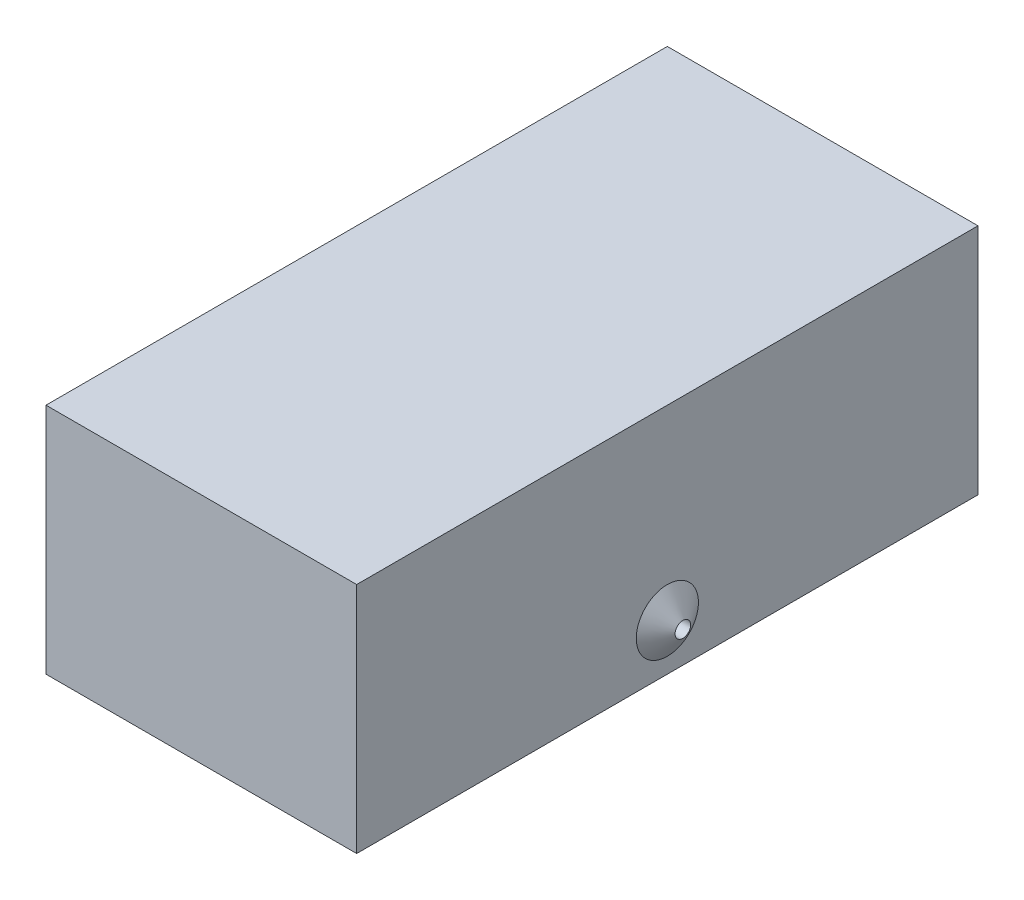
from build123d import *

# Parameters (mm, degrees)
SKETCH2_W           = 100
SKETCH2_H           = 200
BOSS_EXTRUDE1_DEPTH = 75
SKETCH5_R           = 2.5
SKETCH3_R           = 10
SKETCH6_R           = 2.5
CUT_EXTRUDE1_DEPTH  = 4


with BuildPart() as part:
    # Sketch2 → Boss-Extrude1 (new body)
    with BuildSketch(Plane(origin=(0, 0, 0), x_dir=(1, 0, 0), z_dir=(0, 1, 0))):
        Rectangle(SKETCH2_W, SKETCH2_H)
    extrude(amount=BOSS_EXTRUDE1_DEPTH)

    # Sketch5 → Loft1 section 0
    with BuildSketch(Plane.ZY.offset(55)):
        with Locations((0, 15)):
            Circle(SKETCH5_R)
    # Sketch3 → Loft1 section 1
    with BuildSketch(Plane.ZY.offset(50)):
        with Locations((0, 15)):
            Circle(SKETCH3_R)
    loft1 = loft()

    # Sketch6 → Cut-Extrude1 (cut)
    with BuildSketch(Plane.ZY.offset(55)):
        with Locations((0, 15)):
            Circle(SKETCH6_R)
    cut_extrude1 = extrude(amount=-CUT_EXTRUDE1_DEPTH, mode=Mode.SUBTRACT)

    # Mirror1: Loft1, Cut-Extrude1 across plane
    add(loft1.mirror(Plane(origin=(0, 0, 0), x_dir=(0, 0, 1), z_dir=(1, 0, 0))))
    add(cut_extrude1.mirror(Plane(origin=(0, 0, 0), x_dir=(0, 0, 1), z_dir=(1, 0, 0))), mode=Mode.SUBTRACT)


solid = part.part
